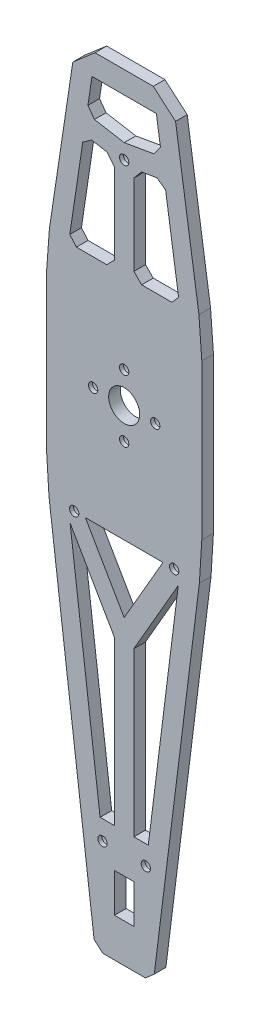
from build123d import *

# Parameters (mm, degrees)
EXTRUDE_1_DEPTH              = 3
CUT_EXTRUDE_1_REACH          = 104.025
SKETCH_2_W                   = 5
SKETCH_2_H                   = 10
HOLE_WIZARD_M2_1_D           = 2.4
HOLE_WIZARD_M2_1_CBORE_D     = 4.4
HOLE_WIZARD_M2_1_CBORE_DEPTH = 2
CUT_EXTRUDE_2_REACH          = 104.025
SKETCH_5_R                   = 4
HOLE_WIZARD_M2_2_D           = 2.4
HOLE_WIZARD_M2_2_CBORE_D     = 4.4
HOLE_WIZARD_M2_2_CBORE_DEPTH = 2
HOLE_WIZARD_M2_3_D           = 2.4
HOLE_WIZARD_M2_3_CBORE_D     = 4.4
HOLE_WIZARD_M2_3_CBORE_DEPTH = 2
CUT_EXTRUDE_3_DEPTH          = 3
HOLE_WIZARD_M2_5_D           = 2.4
HOLE_WIZARD_M2_5_CBORE_D     = 4.4
HOLE_WIZARD_M2_5_CBORE_DEPTH = 2


with BuildPart() as part:
    # 草图1 → 凸台-拉伸1 (new body)
    with BuildSketch(Plane.XY):
        Polygon((20, 5), (20, 45), (19.258297735, 54.944681764), (13.241702265, 95.055318236), (7.5, 100), (-7.5, 100), (-13.241702265, 95.055318236), (-19.258297735, 54.944681764), (-20, 45), (-20, 5), (-19.379826327, -4.961389384), (-7.748069469, -98.015444247), (-5.5, -100), (5.5, -100), (7.748069469, -98.015444247), (19.379826327, -4.961389384), align=None)
    extrude(amount=EXTRUDE_1_DEPTH)

    # 草图2 → 切除-拉伸1 (cut, up to next)
    with BuildSketch(Plane.XY.offset(3), mode=Mode.PRIVATE) as cut_extrude_1_sk1:
        Polygon((10, -5), (-10, -5), (0, -22.320508076), align=None)
    cut_extrude_1_tool1 = extrude(cut_extrude_1_sk1.sketch, amount=-CUT_EXTRUDE_1_REACH, mode=Mode.PRIVATE) & part.part
    # 草图2 → 切除-拉伸1 (cut, up to next)
    with BuildSketch(Plane.XY.offset(3), mode=Mode.PRIVATE) as cut_extrude_1_sk2:
        Polygon((6.211088907, -70), (13.938881842, -8.177656525), (2.5, -27.990381057), (2.5, -70), align=None)
    cut_extrude_1_tool2 = extrude(cut_extrude_1_sk2.sketch, amount=-CUT_EXTRUDE_1_REACH, mode=Mode.PRIVATE) & part.part
    # 草图2 → 切除-拉伸1 (cut, up to next)
    with BuildSketch(Plane.XY.offset(3), mode=Mode.PRIVATE) as cut_extrude_1_sk3:
        Polygon((-13.938881842, -8.177656525), (-2.5, -27.990381057), (-2.5, -70), (-6.211088907, -70), align=None)
    cut_extrude_1_tool3 = extrude(cut_extrude_1_sk3.sketch, amount=-CUT_EXTRUDE_1_REACH, mode=Mode.PRIVATE) & part.part
    # 草图2 → 切除-拉伸1 (cut, up to next)
    with BuildSketch(Plane.XY.offset(3), mode=Mode.PRIVATE) as cut_extrude_1_sk4:
        with Locations((0, -85)):
            Rectangle(SKETCH_2_W, SKETCH_2_H)
    cut_extrude_1_tool4 = extrude(cut_extrude_1_sk4.sketch, amount=-CUT_EXTRUDE_1_REACH, mode=Mode.PRIVATE) & part.part
    add(cut_extrude_1_tool1.solids().sort_by_distance((0, -10.773503, 3))[0], mode=Mode.SUBTRACT)
    add(cut_extrude_1_tool2.solids().sort_by_distance((6.712708, -39.914502, 3))[0], mode=Mode.SUBTRACT)
    add(cut_extrude_1_tool3.solids().sort_by_distance((-6.712708, -39.914502, 3))[0], mode=Mode.SUBTRACT)
    add(cut_extrude_1_tool4.solids().sort_by_distance((0, -85, 3))[0], mode=Mode.SUBTRACT)

    # M2 凹头盖螺钉的柱形沉头孔1 (through all)
    with Locations(Plane(origin=(5.586088907, -75, 0), x_dir=(-1, 0, 0), z_dir=(0, 0, -1))):
        with Locations((0, 0), (11.172177814, 0)):
            CounterBoreHole(HOLE_WIZARD_M2_1_D / 2, HOLE_WIZARD_M2_1_CBORE_D / 2, HOLE_WIZARD_M2_1_CBORE_DEPTH)

    # 草图5 → 切除-拉伸2 (cut, up to next)
    with BuildSketch(Plane(origin=(0, 0, 0), x_dir=(-1, 0, 0), z_dir=(0, 0, -1)), mode=Mode.PRIVATE) as cut_extrude_2_sk1:
        with Locations((0, 25)):
            Circle(SKETCH_5_R)
    cut_extrude_2_tool1 = extrude(cut_extrude_2_sk1.sketch, amount=-CUT_EXTRUDE_2_REACH, mode=Mode.PRIVATE) & part.part
    add(cut_extrude_2_tool1.solids().sort_by_distance((0, 25, 0))[0], mode=Mode.SUBTRACT)

    # M2 凹头盖螺钉的柱形沉头孔2 (through all)
    with Locations(Plane(origin=(8, 25, 0), x_dir=(-1, 0, 0), z_dir=(0, 0, -1))):
        with Locations((0, 0), (8, 8), (16, 0), (8, -8)):
            CounterBoreHole(HOLE_WIZARD_M2_2_D / 2, HOLE_WIZARD_M2_2_CBORE_D / 2, HOLE_WIZARD_M2_2_CBORE_DEPTH)

    # M2 凹头盖螺钉的柱形沉头孔3 (through all)
    with Locations(Plane(origin=(12.880020708, -5.011657807, 0), x_dir=(-1, 0, 0), z_dir=(0, 0, -1))):
        with Locations((0, 0), (25.760041416, 0)):
            CounterBoreHole(HOLE_WIZARD_M2_3_D / 2, HOLE_WIZARD_M2_3_CBORE_D / 2, HOLE_WIZARD_M2_3_CBORE_DEPTH)

    # 草图10 → 切除-拉伸3 (cut)
    with BuildSketch(Plane(origin=(0, 0, 0), x_dir=(-1, 0, 0), z_dir=(0, 0, -1))):
        Polygon((-14.016935065, 56.180852205), (-10.679274874, 78.431920145), (-8.411945476, 80.068406675), (-4.470648492, 79.385634325), (-2.5, 77.04424815), (-2.5, 56.2029795), (-4.5, 54.2029795), (-12.313615971, 54.2029795), align=None)
        Polygon((-9.344020618, 87.333615184), (-8.2970205, 94.313615971), (0, 94.313615971), (8.2970205, 94.313615971), (9.344020618, 87.333615184), (7.670053032, 85.014356303), (0, 83.685631227), (-7.670053032, 85.014356303), align=None)
        Polygon((4.5, 54.2029795), (12.313615971, 54.2029795), (14.016935065, 56.180852205), (10.679274874, 78.431920145), (8.411945476, 80.068406675), (4.470648492, 79.385634325), (2.5, 77.04424815), (2.5, 56.2029795), align=None)
    extrude(amount=-CUT_EXTRUDE_3_DEPTH, mode=Mode.SUBTRACT)

    # M2 凹头盖螺钉的柱形沉头孔5 (through all)
    with Locations(Plane(origin=(0, 79.840052868, 0), x_dir=(-1, 0, 0), z_dir=(0, 0, -1))):
        with Locations((0, 0)):
            CounterBoreHole(HOLE_WIZARD_M2_5_D / 2, HOLE_WIZARD_M2_5_CBORE_D / 2, HOLE_WIZARD_M2_5_CBORE_DEPTH)


solid = part.part
